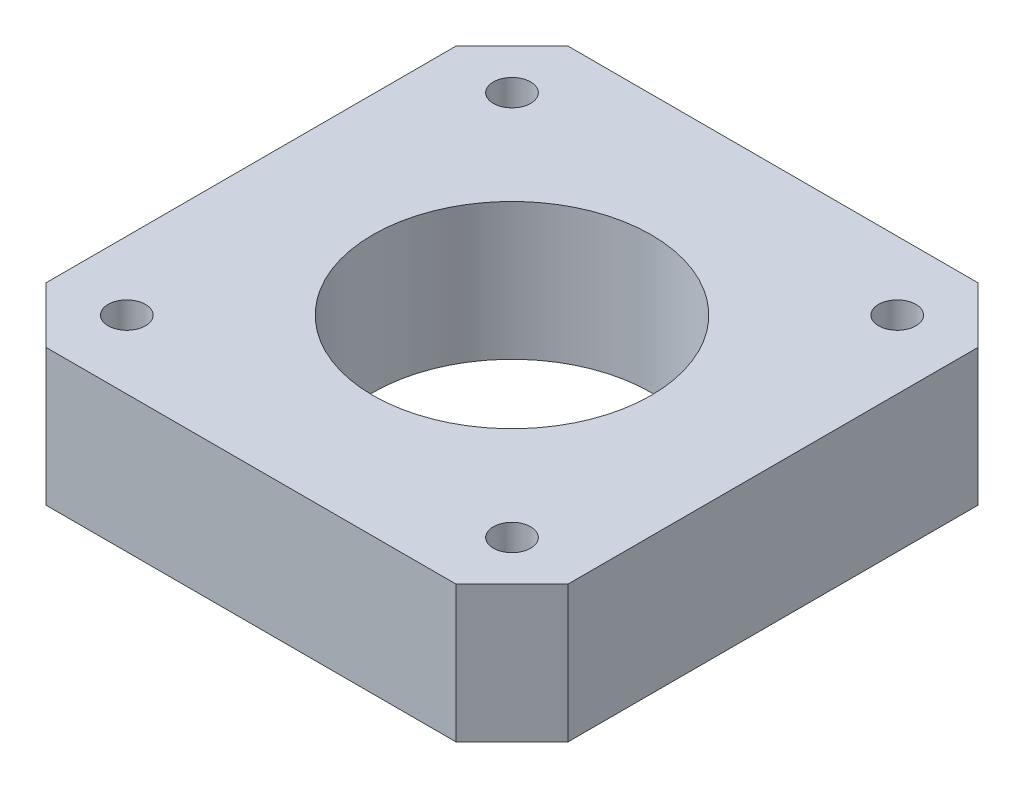
from build123d import *

# Parameters (mm, degrees)
SKETCH1_W           = 42
SKETCH1_H           = 42
BOSS_EXTRUDE1_DEPTH = 11
CHAMFER1_SIZE       = 4.5
CUT_EXTRUDE1_REACH  = 33.67
SKETCH3_R           = 1.5
CUT_EXTRUDE2_REACH  = 33.67
SKETCH4_R           = 11.2


with BuildPart() as part:
    # Sketch1 → Boss-Extrude1 (new body)
    with BuildSketch(Plane(origin=(0, 0, 0), x_dir=(1, 0, 0), z_dir=(0, 1, 0))):
        Rectangle(SKETCH1_W, SKETCH1_H)
    extrude(amount=BOSS_EXTRUDE1_DEPTH)

    # Chamfer1
    chamfer1_edges = [part.edges().sort_by_distance(p)[0] for p in [
        (21, 5.5, 21),
        (-21, 5.5, 21),
        (-21, 5.5, -21),
        (21, 5.5, -21),
    ]]
    chamfer(chamfer1_edges, length=CHAMFER1_SIZE)

    # Sketch3 → Cut-Extrude1 (cut, up to next)
    with BuildSketch(Plane(origin=(0, 11, 0), x_dir=(1, 0, 0), z_dir=(0, 1, 0)), mode=Mode.PRIVATE) as cut_extrude1_sk1:
        with Locations(Location((-15.5, 15.5, 0), (0, 0, 270))):
            Circle(SKETCH3_R)
    cut_extrude1_tool1 = extrude(cut_extrude1_sk1.sketch, amount=-CUT_EXTRUDE1_REACH, mode=Mode.PRIVATE) & part.part
    # Sketch3 → Cut-Extrude1 (cut, up to next)
    with BuildSketch(Plane(origin=(0, 11, 0), x_dir=(1, 0, 0), z_dir=(0, 1, 0)), mode=Mode.PRIVATE) as cut_extrude1_sk2:
        with Locations(Location((15.5, 15.5, 0), (0, 0, 270))):
            Circle(SKETCH3_R)
    cut_extrude1_tool2 = extrude(cut_extrude1_sk2.sketch, amount=-CUT_EXTRUDE1_REACH, mode=Mode.PRIVATE) & part.part
    # Sketch3 → Cut-Extrude1 (cut, up to next)
    with BuildSketch(Plane(origin=(0, 11, 0), x_dir=(1, 0, 0), z_dir=(0, 1, 0)), mode=Mode.PRIVATE) as cut_extrude1_sk3:
        with Locations(Location((15.5, -15.5, 0), (0, 0, 270))):
            Circle(SKETCH3_R)
    cut_extrude1_tool3 = extrude(cut_extrude1_sk3.sketch, amount=-CUT_EXTRUDE1_REACH, mode=Mode.PRIVATE) & part.part
    # Sketch3 → Cut-Extrude1 (cut, up to next)
    with BuildSketch(Plane(origin=(0, 11, 0), x_dir=(1, 0, 0), z_dir=(0, 1, 0)), mode=Mode.PRIVATE) as cut_extrude1_sk4:
        with Locations(Location((-15.5, -15.5, 0), (0, 0, 270))):
            Circle(SKETCH3_R)
    cut_extrude1_tool4 = extrude(cut_extrude1_sk4.sketch, amount=-CUT_EXTRUDE1_REACH, mode=Mode.PRIVATE) & part.part
    add(cut_extrude1_tool1.solids().sort_by_distance((-15.5, 11, -15.5))[0], mode=Mode.SUBTRACT)
    add(cut_extrude1_tool2.solids().sort_by_distance((15.5, 11, -15.5))[0], mode=Mode.SUBTRACT)
    add(cut_extrude1_tool3.solids().sort_by_distance((15.5, 11, 15.5))[0], mode=Mode.SUBTRACT)
    add(cut_extrude1_tool4.solids().sort_by_distance((-15.5, 11, 15.5))[0], mode=Mode.SUBTRACT)

    # Sketch4 → Cut-Extrude2 (cut, up to next)
    with BuildSketch(Plane(origin=(0, 11, 0), x_dir=(1, 0, 0), z_dir=(0, 1, 0)), mode=Mode.PRIVATE) as cut_extrude2_sk1:
        with Locations(Location((0, 0, 0), (0, 0, 270))):
            Circle(SKETCH4_R)
    cut_extrude2_tool1 = extrude(cut_extrude2_sk1.sketch, amount=-CUT_EXTRUDE2_REACH, mode=Mode.PRIVATE) & part.part
    add(cut_extrude2_tool1.solids().sort_by_distance((0, 11, 0))[0], mode=Mode.SUBTRACT)


solid = part.part
